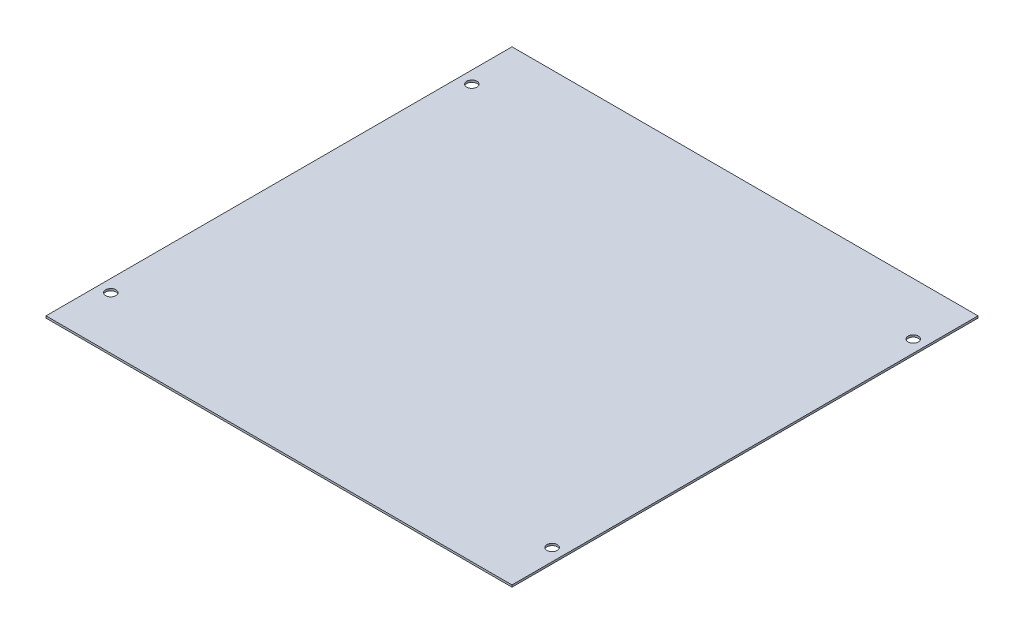
from build123d import *

# Parameters (mm, degrees)
SKETCH1_W           = 295
SKETCH1_H           = 295
BOSS_EXTRUDE1_DEPTH = 1.27
SKETCH2_R           = 3.25
CUT_EXTRUDE1_DEPTH  = 209.600366491


with BuildPart() as part:
    # Sketch1 → Boss-Extrude1 (new body)
    with BuildSketch(Plane(origin=(0, 0, 0), x_dir=(1, 0, 0), z_dir=(0, 1, 0))):
        Rectangle(SKETCH1_W, SKETCH1_H)
    extrude(amount=BOSS_EXTRUDE1_DEPTH)

    # Sketch2 → Cut-Extrude1 (cut, through all)
    with BuildSketch(Plane(origin=(0, 1.27, 0), x_dir=(1, 0, 0), z_dir=(0, 1, 0))):
        with Locations(Location((-139.7, 114.3, 0), (0, 0, 270))):
            Circle(SKETCH2_R)
        with Locations(Location((139.7, 114.3, 0), (0, 0, 270))):
            Circle(SKETCH2_R)
        with Locations(Location((139.7, -114.3, 0), (0, 0, 270))):
            Circle(SKETCH2_R)
        with Locations(Location((-139.7, -114.3, 0), (0, 0, 270))):
            Circle(SKETCH2_R)
    extrude(amount=-CUT_EXTRUDE1_DEPTH, mode=Mode.SUBTRACT)


solid = part.part
